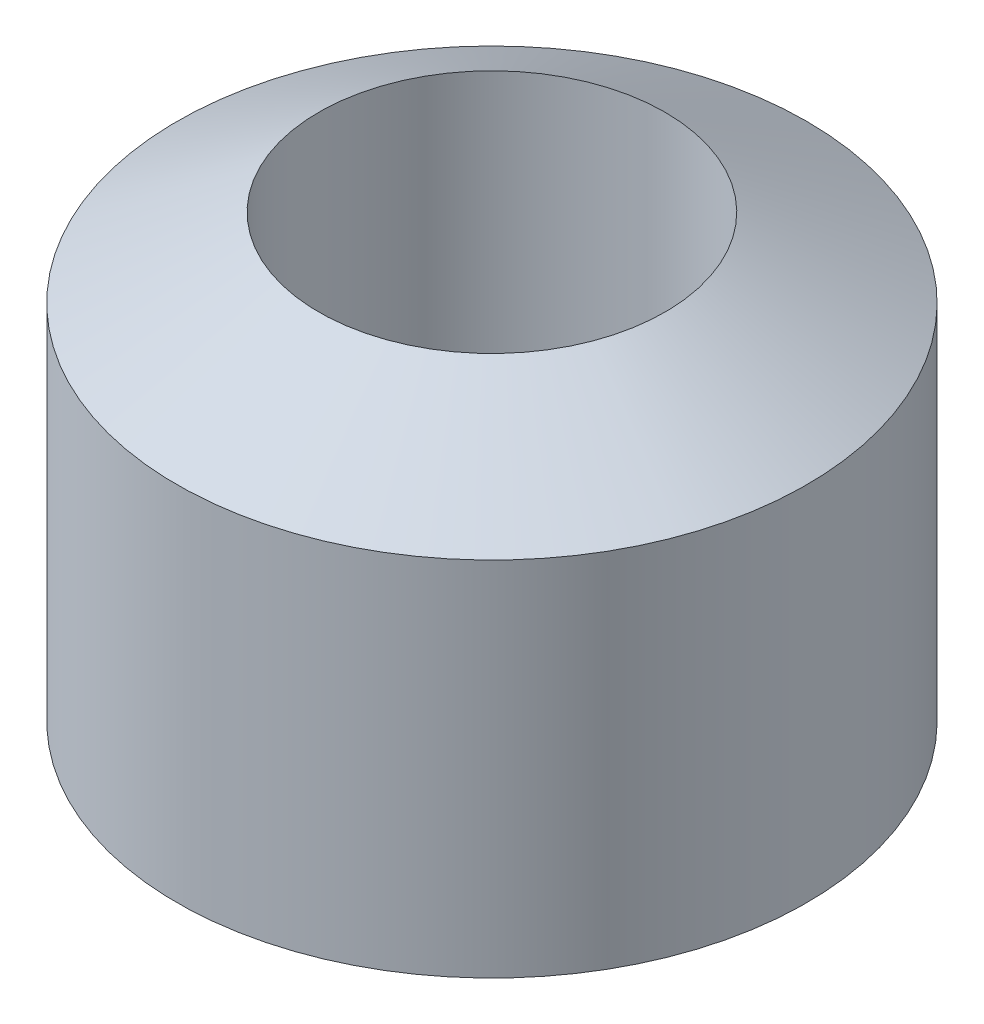
from build123d import *


with BuildPart() as part:
    # Sketch1 → Revolve1 (revolve)
    with BuildSketch(Plane.XY, mode=Mode.PRIVATE) as revolve1_sk:
        Polygon((5.5, 0), (10, 2.5), (10, 14), (5.5, 16.5), align=None)
    revolve(revolve1_sk.sketch.rotate(Axis((0, 0, 0), (0, 1, 0)), 90), axis=Axis((0, 0, 0), (0, 1, 0)))


solid = part.part
